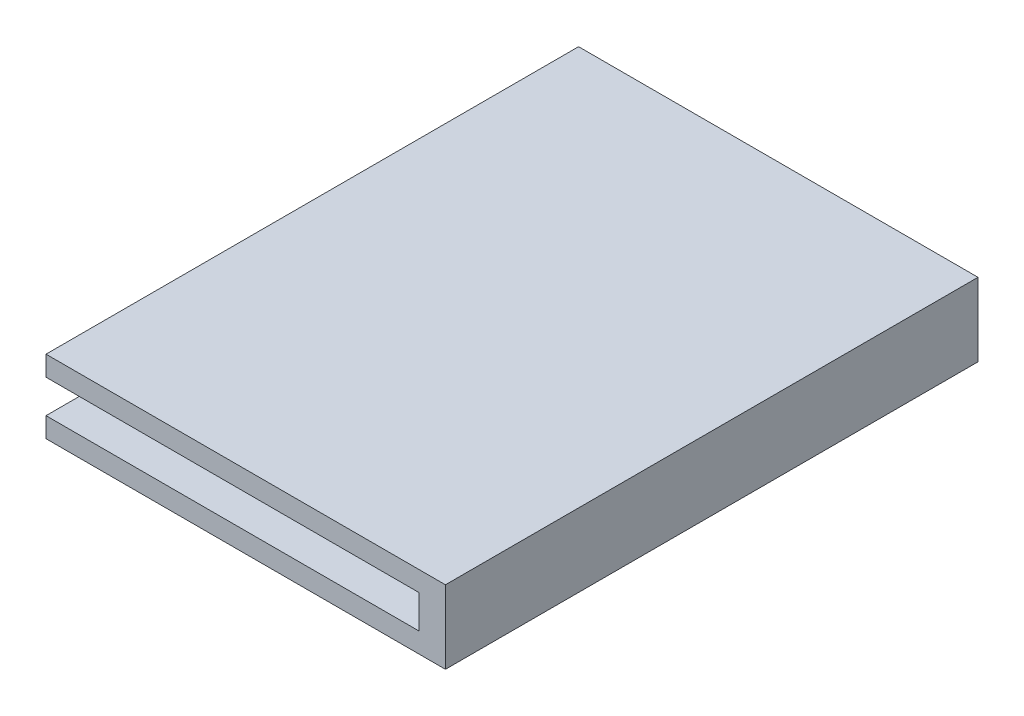
from build123d import *

# Parameters (mm, degrees)
P_IDAT_VYSUNUT_M1_DEPTH = 80


with BuildPart() as part:
    # Skica1 → Přidat vysunutím1 (new body)
    with BuildSketch(Plane.XY):
        Polygon((0, 0), (0, -5), (-56, -5), (-56, -8), (4, -8), (4, 3), (-56, 3), (-56, 0), align=None)
    extrude(amount=P_IDAT_VYSUNUT_M1_DEPTH)


solid = part.part
